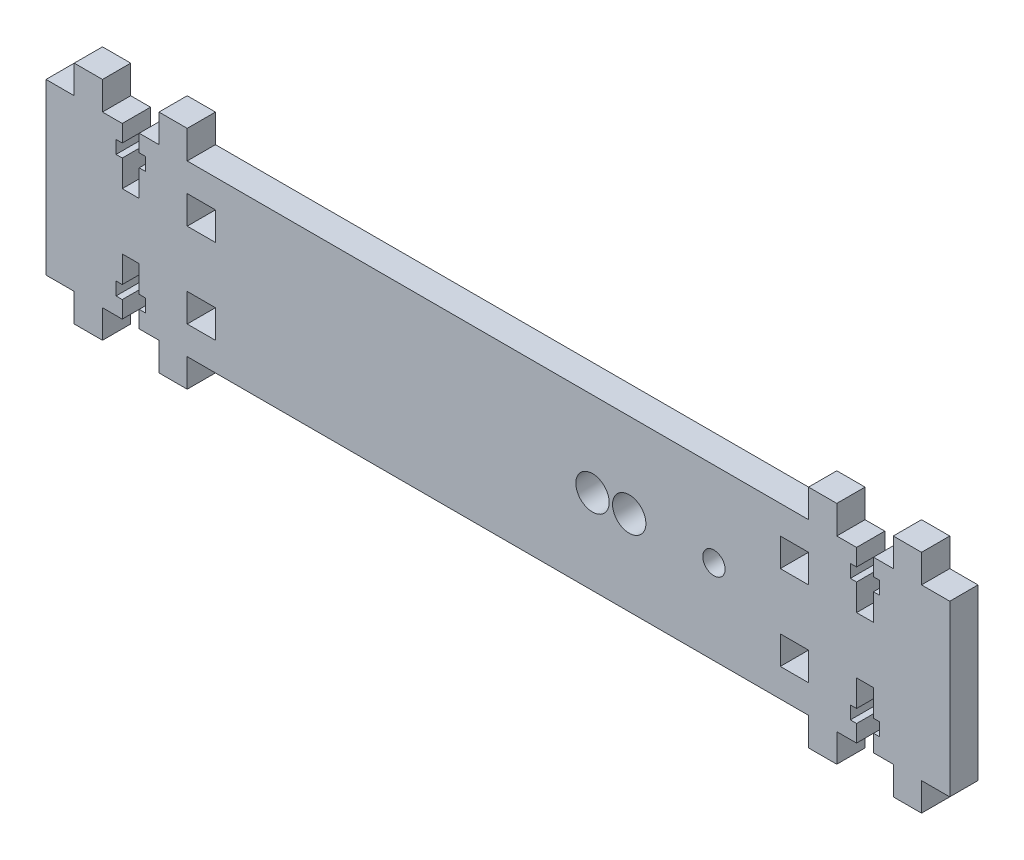
from build123d import *

# Parameters (mm, degrees)
SKETCH2_R           = 2.95
SKETCH2_R_2         = 1.975
SKETCH2_W           = 5
SKETCH2_H           = 5
BOSS_EXTRUDE1_DEPTH = 5


with BuildPart() as part:
    # Sketch2 → Boss-Extrude1 (new body)
    with BuildSketch(Plane.XY):
        Polygon((66.5, 15), (70, 15), (70, 20), (75, 20), (75, 15), (80, 15), (80, -15), (75, -15), (75, -20), (70, -20), (70, -15), (66.5, -15), (66.5, -12), (67.6, -12), (67.6, -9.7), (66.5, -9.7), (66.5, -5), (63.5, -5), (63.5, -9.7), (62.4, -9.7), (62.4, -12), (63.5, -12), (63.5, -15), (60, -15), (60, -20), (55, -20), (55, -15), (-55, -15), (-55, -20), (-60, -20), (-60, -15), (-63.5, -15), (-63.5, -12), (-62.4, -12), (-62.4, -9.7), (-63.5, -9.7), (-63.5, -5), (-66.5, -5), (-66.5, -9.7), (-67.6, -9.7), (-67.6, -12), (-66.5, -12), (-66.5, -15), (-70, -15), (-70, -20), (-75, -20), (-75, -15), (-80, -15), (-80, 15), (-75, 15), (-75, 20), (-70, 20), (-70, 15), (-66.5, 15), (-66.5, 12), (-67.6, 12), (-67.6, 9.7), (-66.5, 9.7), (-66.5, 5), (-63.5, 5), (-63.5, 9.7), (-62.4, 9.7), (-62.4, 12), (-63.5, 12), (-63.5, 15), (-60, 15), (-60, 20), (-55, 20), (-55, 15), (55, 15), (55, 20), (60, 20), (60, 15), (63.5, 15), (63.5, 12), (62.4, 12), (62.4, 9.7), (63.5, 9.7), (63.5, 5), (66.5, 5), (66.5, 9.7), (67.6, 9.7), (67.6, 12), (66.5, 12), align=None)
        with Locations((23.25, 0)):
            Circle(SKETCH2_R, mode=Mode.SUBTRACT)
        with Locations(Location((16.75, 0, 0), (0, 0, 180))):
            Circle(SKETCH2_R, mode=Mode.SUBTRACT)
        with Locations((38.25, 0)):
            Circle(SKETCH2_R_2, mode=Mode.SUBTRACT)
        with Locations((-52.5, 7.5)):
            Rectangle(SKETCH2_W, SKETCH2_H, mode=Mode.SUBTRACT)
        with Locations((-52.5, -7.5)):
            Rectangle(SKETCH2_W, SKETCH2_H, mode=Mode.SUBTRACT)
        with Locations((52.5, 7.5)):
            Rectangle(SKETCH2_W, SKETCH2_H, mode=Mode.SUBTRACT)
        with Locations((52.5, -7.5)):
            Rectangle(SKETCH2_W, SKETCH2_H, mode=Mode.SUBTRACT)
    extrude(amount=BOSS_EXTRUDE1_DEPTH)


solid = part.part
